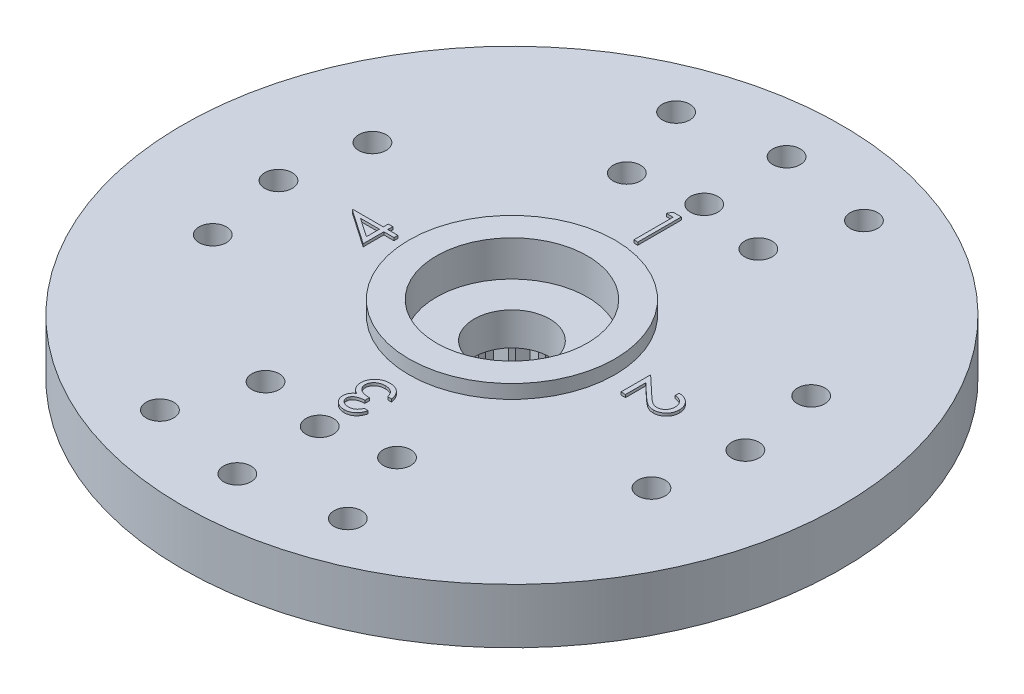
from build123d import *

# Parameters (mm, degrees)
SKETCH1_R           = 12
SKETCH1_R_2         = 1.375
SKETCH1_R_3         = 0.5
BOSS_EXTRUDE1_DEPTH = 2
SKETCH2_R           = 3.75
SKETCH2_R_2         = 2.75
BOSS_EXTRUDE2_DEPTH = 0.5
CUT_EXTRUDE1_START  = -0.8
SKETCH3_R           = 2.75
SKETCH3_R_2         = 1.375
CUT_EXTRUDE1_DEPTH  = 0.8
SKETCH4_R           = 4.5
SKETCH4_R_2         = 2.5
BOSS_EXTRUDE3_DEPTH = 2.5
CUT_EXTRUDE3_START  = -2.5
CUT_EXTRUDE3_DEPTH  = 2.5
BOSS_EXTRUDE4_DEPTH = 0.1


with BuildPart() as part:
    # Sketch1 → Boss-Extrude1 (new body)
    with BuildSketch(Plane(origin=(0, 0, 0), x_dir=(1, 0, 0), z_dir=(0, 1, 0))):
        with Locations(Location((0, 0, 0), (0, 0, 270))):
            Circle(SKETCH1_R)
        with Locations(Location((0, 0, 0), (0, 0, 270))):
            Circle(SKETCH1_R_2, mode=Mode.SUBTRACT)
        with Locations(Location((0, 10, 0), (0, 0, 270))):
            Circle(SKETCH1_R_3, mode=Mode.SUBTRACT)
        with Locations(Location((-3.420201433, 9.396926208, 0), (0, 0, 270))):
            Circle(SKETCH1_R_3, mode=Mode.SUBTRACT)
        with Locations(Location((3.420201433, 9.396926208, 0), (0, 0, 270))):
            Circle(SKETCH1_R_3, mode=Mode.SUBTRACT)
        with Locations(Location((0, 7, 0), (0, 0, 270))):
            Circle(SKETCH1_R_3, mode=Mode.SUBTRACT)
        with Locations(Location((-2.394141003, 6.577848346, 0), (0, 0, 270))):
            Circle(SKETCH1_R_3, mode=Mode.SUBTRACT)
        with Locations(Location((2.394141003, 6.577848346, 0), (0, 0, 270))):
            Circle(SKETCH1_R_3, mode=Mode.SUBTRACT)
        with Locations(Location((8.5, 0, 0), (0, 0, 270))):
            Circle(SKETCH1_R_3, mode=Mode.SUBTRACT)
        with Locations(Location((7.987387277, 2.907171218, 0), (0, 0, 270))):
            Circle(SKETCH1_R_3, mode=Mode.SUBTRACT)
        with Locations(Location((7.987387277, -2.907171218, 0), (0, 0, 270))):
            Circle(SKETCH1_R_3, mode=Mode.SUBTRACT)
        with Locations(Location((-2.394141003, -6.577848346, 0), (0, 0, 90))):
            Circle(SKETCH1_R_3, mode=Mode.SUBTRACT)
        with Locations(Location((0, -7, 0), (0, 0, 90))):
            Circle(SKETCH1_R_3, mode=Mode.SUBTRACT)
        with Locations(Location((2.394141003, -6.577848346, 0), (0, 0, 90))):
            Circle(SKETCH1_R_3, mode=Mode.SUBTRACT)
        with Locations(Location((3.420201433, -9.396926208, 0), (0, 0, 90))):
            Circle(SKETCH1_R_3, mode=Mode.SUBTRACT)
        with Locations(Location((0, -10, 0), (0, 0, 90))):
            Circle(SKETCH1_R_3, mode=Mode.SUBTRACT)
        with Locations(Location((-3.420201433, -9.396926208, 0), (0, 0, 90))):
            Circle(SKETCH1_R_3, mode=Mode.SUBTRACT)
        with Locations(Location((-7.987387277, -2.907171218, 0), (0, 0, 90))):
            Circle(SKETCH1_R_3, mode=Mode.SUBTRACT)
        with Locations(Location((-8.5, 0, 0), (0, 0, 90))):
            Circle(SKETCH1_R_3, mode=Mode.SUBTRACT)
        with Locations(Location((-7.987387277, 2.907171218, 0), (0, 0, 90))):
            Circle(SKETCH1_R_3, mode=Mode.SUBTRACT)
    extrude(amount=BOSS_EXTRUDE1_DEPTH)

    # Sketch2 → Boss-Extrude2 (add)
    with BuildSketch(Plane(origin=(0, 2, 0), x_dir=(1, 0, 0), z_dir=(0, 1, 0))):
        with Locations(Location((0, 0, 0), (0, 0, 270))):
            Circle(SKETCH2_R)
        with Locations(Location((0, 0, 0), (0, 0, 270))):
            Circle(SKETCH2_R_2, mode=Mode.SUBTRACT)
    extrude(amount=BOSS_EXTRUDE2_DEPTH)

    # Sketch3 → Cut-Extrude1 (cut)
    with BuildSketch(Plane(origin=(0, 2, 0), x_dir=(1, 0, 0), z_dir=(0, 1, 0)).offset(CUT_EXTRUDE1_START)):
        with Locations(Location((0, 0, 0), (0, 0, 270))):
            Circle(SKETCH3_R)
        with Locations(Location((0, 0, 0), (0, 0, 270))):
            Circle(SKETCH3_R_2, mode=Mode.SUBTRACT)
    extrude(amount=CUT_EXTRUDE1_DEPTH, mode=Mode.SUBTRACT)

    # Sketch4 → Boss-Extrude3 (add)
    with BuildSketch(Plane.XZ):
        with Locations(Location((0, 0, 0), (0, 0, 90))):
            Circle(SKETCH4_R)
        with Locations(Location((0, 0, 0), (0, 0, 270))):
            Circle(SKETCH4_R_2, mode=Mode.SUBTRACT)
    extrude(amount=BOSS_EXTRUDE3_DEPTH)

    # Sketch5 → Cut-Extrude3 (cut)
    with BuildSketch(Plane.XZ.offset(2.5).offset(CUT_EXTRUDE3_START)):
        with BuildLine():
            Line((0.299038106, 2.482050808), (0, 3))
            Line((0, 3), (-0.299038106, 2.482050808))
            ThreePointArc((-0.299038106, 2.482050808), (-0.391086163, 2.469220851), (-0.482593741, 2.452978451))
            Line((-0.482593741, 2.452978451), (-0.927050983, 2.853169549))
            Line((-0.927050983, 2.853169549), (-1.051398019, 2.268162738))
            ThreePointArc((-1.051398019, 2.268162738), (-1.134976249, 2.22751631), (-1.216985951, 2.183791473))
            Line((-1.216985951, 2.183791473), (-1.763355757, 2.427050983))
            Line((-1.763355757, 2.427050983), (-1.70083977, 1.832251096))
            ThreePointArc((-1.70083977, 1.832251096), (-1.767766953, 1.767766953), (-1.832251096, 1.70083977))
            Line((-1.832251096, 1.70083977), (-2.427050983, 1.763355757))
            Line((-2.427050983, 1.763355757), (-2.183791473, 1.216985951))
            ThreePointArc((-2.183791473, 1.216985951), (-2.22751631, 1.134976249), (-2.268162738, 1.051398019))
            Line((-2.268162738, 1.051398019), (-2.853169549, 0.927050983))
            Line((-2.853169549, 0.927050983), (-2.452978451, 0.482593741))
            ThreePointArc((-2.452978451, 0.482593741), (-2.469220851, 0.391086163), (-2.482050808, 0.299038106))
            Line((-2.482050808, 0.299038106), (-3, 0))
            Line((-3, 0), (-2.482050808, -0.299038106))
            ThreePointArc((-2.482050808, -0.299038106), (-2.469220851, -0.391086163), (-2.452978451, -0.482593741))
            Line((-2.452978451, -0.482593741), (-2.853169549, -0.927050983))
            Line((-2.853169549, -0.927050983), (-2.268162738, -1.051398019))
            ThreePointArc((-2.268162738, -1.051398019), (-2.22751631, -1.134976249), (-2.183791473, -1.216985951))
            Line((-2.183791473, -1.216985951), (-2.427050983, -1.763355757))
            Line((-2.427050983, -1.763355757), (-1.832251096, -1.70083977))
            ThreePointArc((-1.832251096, -1.70083977), (-1.767766953, -1.767766953), (-1.70083977, -1.832251096))
            Line((-1.70083977, -1.832251096), (-1.763355757, -2.427050983))
            Line((-1.763355757, -2.427050983), (-1.216985951, -2.183791473))
            ThreePointArc((-1.216985951, -2.183791473), (-1.134976249, -2.22751631), (-1.051398019, -2.268162738))
            Line((-1.051398019, -2.268162738), (-0.927050983, -2.853169549))
            Line((-0.927050983, -2.853169549), (-0.482593741, -2.452978451))
            ThreePointArc((-0.482593741, -2.452978451), (-0.391086163, -2.469220851), (-0.299038106, -2.482050808))
            Line((-0.299038106, -2.482050808), (0, -3))
            Line((0, -3), (0.299038106, -2.482050808))
            ThreePointArc((0.299038106, -2.482050808), (0.391086163, -2.469220851), (0.482593741, -2.452978451))
            Line((0.482593741, -2.452978451), (0.927050983, -2.853169549))
            Line((0.927050983, -2.853169549), (1.051398019, -2.268162738))
            ThreePointArc((1.051398019, -2.268162738), (1.134976249, -2.22751631), (1.216985951, -2.183791473))
            Line((1.216985951, -2.183791473), (1.763355757, -2.427050983))
            Line((1.763355757, -2.427050983), (1.70083977, -1.832251096))
            ThreePointArc((1.70083977, -1.832251096), (1.767766953, -1.767766953), (1.832251096, -1.70083977))
            Line((1.832251096, -1.70083977), (2.427050983, -1.763355757))
            Line((2.427050983, -1.763355757), (2.183791473, -1.216985951))
            ThreePointArc((2.183791473, -1.216985951), (2.22751631, -1.134976249), (2.268162738, -1.051398019))
            Line((2.268162738, -1.051398019), (2.853169549, -0.927050983))
            Line((2.853169549, -0.927050983), (2.452978451, -0.482593741))
            ThreePointArc((2.452978451, -0.482593741), (2.469220851, -0.391086163), (2.482050808, -0.299038106))
            Line((2.482050808, -0.299038106), (3, 0))
            Line((3, 0), (2.482050808, 0.299038106))
            ThreePointArc((2.482050808, 0.299038106), (2.469220851, 0.391086163), (2.452978451, 0.482593741))
            Line((2.452978451, 0.482593741), (2.853169549, 0.927050983))
            Line((2.853169549, 0.927050983), (2.268162738, 1.051398019))
            ThreePointArc((2.268162738, 1.051398019), (2.22751631, 1.134976249), (2.183791473, 1.216985951))
            Line((2.183791473, 1.216985951), (2.427050983, 1.763355757))
            Line((2.427050983, 1.763355757), (1.832251096, 1.70083977))
            ThreePointArc((1.832251096, 1.70083977), (1.767766953, 1.767766953), (1.70083977, 1.832251096))
            Line((1.70083977, 1.832251096), (1.763355757, 2.427050983))
            Line((1.763355757, 2.427050983), (1.216985951, 2.183791473))
            ThreePointArc((1.216985951, 2.183791473), (1.134976249, 2.22751631), (1.051398019, 2.268162738))
            Line((1.051398019, 2.268162738), (0.927050983, 2.853169549))
            Line((0.927050983, 2.853169549), (0.482593741, 2.452978451))
            ThreePointArc((0.482593741, 2.452978451), (0.391086163, 2.469220851), (0.299038106, 2.482050808))
        make_face()
    extrude(amount=CUT_EXTRUDE3_DEPTH, mode=Mode.SUBTRACT)

    # Sketch6 → Boss-Extrude4 (add)
    # profile 1 of 4: a face of its own
    with BuildSketch(Plane(origin=(0, 2, 0), x_dir=(1, 0, 0), z_dir=(0, 1, 0))):
        Polygon((-0.212111879, 6.0875), (0.081410256, 6.0875), (0.081410256, 4.5), (-0.061057692, 4.5), (-0.061057692, 5.924679487), (-0.305288462, 5.924679487), align=None)
    # profile 2 of 4: a face of its own
    with BuildSketch(Plane(origin=(0, 2, 0), x_dir=(1, 0, 0), z_dir=(0, 1, 0))):
        with BuildLine():
            Line((5.599038462, 0.34599359), (5.599038462, 0.488461538))
            add(Edge.make_bspline(
                [(5.599038462, 0.488461538), (5.617939279, 0.487533166), (5.655059981, 0.485709868), (5.709180577, 0.477167658), (5.760917347, 0.46495614), (5.809826741, 0.447649569), (5.856493025, 0.426277468), (5.900296523, 0.40011183), (5.941671981, 0.369710466), (5.979836023, 0.335129148), (6.014722729, 0.29760523), (6.045167992, 0.25736354), (6.070596953, 0.214817686), (6.091970581, 0.170336692), (6.107994605, 0.123406123), (6.119889389, 0.074474582), (6.127044708, 0.023320904), (6.12781392, -0.011531495), (6.128205128, -0.029256811)],
                knots=[0, 0, 0, 0, 1.100776268, 2.161895295, 3.184016182, 4.190939212, 5.176500551, 6.166955529, 7.155448256, 8.160289653, 9.16017456, 10.133824356, 11.091467644, 12.04088621, 13.000931625, 13.972173743, 14.968683325, 16, 16, 16, 16], degree=3))
            add(Edge.make_bspline(
                [(6.128205128, -0.029256811), (6.127797614, -0.046664009), (6.126996863, -0.080868531), (6.120120254, -0.130789516), (6.109349932, -0.178313503), (6.094239011, -0.223347597), (6.073926074, -0.265532491), (6.049525047, -0.305185086), (6.02130391, -0.342777454), (5.988078073, -0.376616959), (5.952607706, -0.407690267), (5.914739978, -0.434497361), (5.875628838, -0.457454046), (5.834976046, -0.476589172), (5.79239883, -0.490675349), (5.748517063, -0.501369751), (5.702876523, -0.507414685), (5.671985336, -0.50834243), (5.656280048, -0.508814103)],
                knots=[0, 0, 0, 0, 1.111607364, 2.184268762, 3.212621178, 4.221274766, 5.211760367, 6.196651075, 7.1921475, 8.207485113, 9.220403448, 10.201281604, 11.166441695, 12.114753415, 13.065576456, 14.026450734, 14.996634279, 16, 16, 16, 16], degree=3))
            add(Edge.make_bspline(
                [(5.656280048, -0.508814103), (5.634169423, -0.508046087), (5.590336183, -0.506523533), (5.525922299, -0.493499512), (5.463513856, -0.473158416), (5.413286579, -0.448666758), (5.372812816, -0.423959614), (5.339489511, -0.401694923), (5.30360953, -0.375630526), (5.265293024, -0.345387065), (5.224239863, -0.311590155), (5.180474849, -0.273933674), (5.134450153, -0.232149094), (5.103015113, -0.202821846), (5.086726262, -0.1876252)],
                knots=[0, 0, 0, 0, 1.184426356, 2.348067706, 3.509069118, 4.696110526, 5.333549288, 6.050745305, 6.844228056, 7.710549037, 8.667450064, 9.695053472, 10.805634456, 12, 12, 12, 12], degree=3))
            Line((5.086726262, -0.1876252), (4.662820513, 0.209567808))
            Line((4.662820513, 0.209567808), (4.662820513, -0.529166667))
            Line((4.662820513, -0.529166667), (4.5, -0.529166667))
            Line((4.5, -0.529166667), (4.5, 0.549519231))
            Line((4.5, 0.549519231), (5.15700621, -0.066145833))
            add(Edge.make_bspline(
                [(5.15700621, -0.066145833), (5.172652803, -0.081136472), (5.202706705, -0.10993042), (5.246597776, -0.15063927), (5.287268318, -0.187261175), (5.324898551, -0.219820431), (5.359275147, -0.248343825), (5.390667508, -0.272740096), (5.418806234, -0.293117072), (5.451862432, -0.31471242), (5.492269991, -0.335305017), (5.541401752, -0.353403803), (5.592090897, -0.364360562), (5.626334746, -0.36568164), (5.643559696, -0.366346154)],
                knots=[0, 0, 0, 0, 1.329530082, 2.553755191, 3.672934919, 4.687409497, 5.60679272, 6.413407421, 7.126401618, 7.737995624, 8.834647426, 9.90044882, 10.943907757, 12, 12, 12, 12], degree=3))
            add(Edge.make_bspline(
                [(5.643559696, -0.366346154), (5.654392812, -0.366060761), (5.675742806, -0.365498307), (5.707024672, -0.360440353), (5.737316681, -0.353009214), (5.766244292, -0.341555532), (5.794376458, -0.327794356), (5.820857871, -0.310213439), (5.846591221, -0.290123068), (5.87069413, -0.266819222), (5.892776139, -0.241235929), (5.912335573, -0.214204803), (5.928681993, -0.185607306), (5.94208205, -0.155562618), (5.952593749, -0.124154868), (5.959877459, -0.091323211), (5.964450586, -0.057158391), (5.965069336, -0.033829626), (5.965384615, -0.021942608)],
                knots=[0, 0, 0, 0, 0.991504627, 1.954065223, 2.895985987, 3.842598665, 4.797835564, 5.759220273, 6.74786863, 7.784730864, 8.824135544, 9.839918996, 10.835834653, 11.835434876, 12.84861661, 13.863796685, 14.911511676, 16, 16, 16, 16], degree=3))
            add(Edge.make_bspline(
                [(5.965384615, -0.021942608), (5.965060395, -0.009527925), (5.964423681, 0.014852462), (5.959967009, 0.050647099), (5.952285925, 0.084797422), (5.941755322, 0.117372561), (5.928497209, 0.148403903), (5.911665037, 0.177610862), (5.891915995, 0.205260088), (5.869403165, 0.231300798), (5.844219896, 0.255228126), (5.816492727, 0.276692883), (5.786041295, 0.295000051), (5.753553406, 0.311228532), (5.718165248, 0.323645722), (5.680734357, 0.334259816), (5.64072893, 0.341970171), (5.613166096, 0.344630175), (5.599038462, 0.34599359)],
                knots=[0, 0, 0, 0, 1.031212865, 2.025131798, 2.990757446, 3.934781266, 4.865570067, 5.788494791, 6.729227313, 7.684356718, 8.643577152, 9.610526866, 10.590658432, 11.59095419, 12.621640561, 13.700587263, 14.82141059, 16, 16, 16, 16], degree=3))
        make_face()
    # profile 3 of 4: a face of its own
    with BuildSketch(Plane(origin=(0, 2, 0), x_dir=(1, 0, 0), z_dir=(0, 1, 0))):
        with BuildLine():
            Line((0.34599359, -5.721153846), (0.488461538, -5.721153846))
            add(Edge.make_bspline(
                [(0.488461538, -5.721153846), (0.484601849, -5.737134294), (0.477056473, -5.768374763), (0.461318645, -5.813009485), (0.444173983, -5.855247654), (0.423586782, -5.894298373), (0.401131025, -5.930946447), (0.37540322, -5.964360657), (0.347590345, -5.995390823), (0.316826886, -6.022928613), (0.284564958, -6.04786494), (0.250349969, -6.069126127), (0.2148703, -6.08741601), (0.177880129, -6.102483759), (0.139269329, -6.113834621), (0.099386965, -6.122070029), (0.05812852, -6.127418142), (0.030121577, -6.127940095), (0.015900441, -6.128205128)],
                knots=[0, 0, 0, 0, 1.162005537, 2.271625781, 3.343758855, 4.383309926, 5.390229558, 6.379919256, 7.361854164, 8.333198761, 9.295911338, 10.242430842, 11.177959212, 12.116337295, 13.062827104, 14.020064771, 14.994644689, 16, 16, 16, 16], degree=3))
            add(Edge.make_bspline(
                [(0.015900441, -6.128205128), (-0.004819946, -6.127579549), (-0.045808747, -6.126342036), (-0.106026272, -6.115041559), (-0.164095579, -6.097159445), (-0.21938106, -6.072451719), (-0.270733706, -6.041977474), (-0.316424762, -6.005707754), (-0.355834908, -5.964342356), (-0.388897715, -5.918652943), (-0.414785304, -5.86982348), (-0.43387448, -5.819567694), (-0.445495743, -5.7680048), (-0.447001853, -5.733189891), (-0.44775641, -5.715747696)],
                knots=[0, 0, 0, 0, 1.083050992, 2.142477498, 3.193116406, 4.255571735, 5.30263384, 6.308962982, 7.297363603, 8.282367274, 9.249857812, 10.179914175, 11.08814088, 12, 12, 12, 12], degree=3))
            add(Edge.make_bspline(
                [(-0.44775641, -5.715747696), (-0.447228639, -5.698962472), (-0.446195871, -5.666116392), (-0.437426655, -5.618164141), (-0.422669136, -5.572969558), (-0.402226779, -5.530342388), (-0.375764719, -5.490552907), (-0.343709603, -5.453511592), (-0.305835181, -5.419054153), (-0.277133663, -5.399314963), (-0.262357272, -5.389152644)],
                knots=[0, 0, 0, 0, 1.024540389, 2.004866551, 2.965041327, 3.920577974, 4.882998113, 5.874504559, 6.905732034, 8, 8, 8, 8], degree=3))
            add(Edge.make_bspline(
                [(-0.262357272, -5.389152644), (-0.279266057, -5.38102782), (-0.312821544, -5.364904106), (-0.358097689, -5.332780608), (-0.399825574, -5.296601576), (-0.422822908, -5.268052723), (-0.43440004, -5.253680889)],
                knots=[0, 0, 0, 0, 1.015663554, 2.015584519, 3.001021554, 4, 4, 4, 4], degree=3))
            add(Edge.make_bspline(
                [(-0.43440004, -5.253680889), (-0.442041901, -5.243223667), (-0.457200483, -5.222480465), (-0.475858316, -5.189110161), (-0.492978135, -5.155480456), (-0.505577827, -5.120269074), (-0.516450862, -5.084607067), (-0.523604956, -5.047730768), (-0.528197599, -5.009990535), (-0.5288425, -4.984446887), (-0.529166667, -4.971607071)],
                knots=[0, 0, 0, 0, 1.02516404, 2.033540309, 3.025129118, 4.011046665, 4.991655828, 5.976607087, 6.982917762, 8, 8, 8, 8], degree=3))
            add(Edge.make_bspline(
                [(-0.529166667, -4.971607071), (-0.528350817, -4.94937866), (-0.526722958, -4.905026444), (-0.512235463, -4.839481871), (-0.489636803, -4.775530087), (-0.458141824, -4.71407805), (-0.418998333, -4.656756936), (-0.372686258, -4.605322495), (-0.319156288, -4.561514187), (-0.259966982, -4.524586511), (-0.195593193, -4.495321744), (-0.127013944, -4.474234108), (-0.05463527, -4.461584484), (-0.005138768, -4.460066765), (0.020034555, -4.459294872)],
                knots=[0, 0, 0, 0, 0.955619592, 1.906742024, 2.874954321, 3.868585453, 4.869520953, 5.854611167, 6.836527075, 7.836578462, 8.849204403, 9.870874567, 10.917152508, 12, 12, 12, 12], degree=3))
            add(Edge.make_bspline(
                [(0.020034555, -4.459294872), (0.037005812, -4.459692103), (0.070399587, -4.460473722), (0.11951096, -4.465721886), (0.166290723, -4.475567824), (0.211193125, -4.487950453), (0.253540479, -4.505070826), (0.293941914, -4.525481482), (0.332220335, -4.549705826), (0.36814842, -4.577784596), (0.401687783, -4.60921458), (0.431983954, -4.644517919), (0.459372127, -4.683035728), (0.48367828, -4.725114484), (0.50500471, -4.770636328), (0.52289247, -4.819783675), (0.538510693, -4.872175513), (0.545786309, -4.908676289), (0.549519231, -4.927403846)],
                knots=[0, 0, 0, 0, 1.048603596, 2.063302207, 3.045874044, 3.999447474, 4.937100059, 5.862643889, 6.7929026, 7.7308982, 8.676022965, 9.627908155, 10.600123445, 11.591992905, 12.626222643, 13.701663232, 14.820785756, 16, 16, 16, 16], degree=3))
            Line((0.549519231, -4.927403846), (0.407051282, -4.927403846))
            add(Edge.make_bspline(
                [(0.407051282, -4.927403846), (0.403339575, -4.915180544), (0.396119982, -4.891405159), (0.383830783, -4.857187592), (0.369829816, -4.825819475), (0.354809999, -4.797070701), (0.339035489, -4.770658147), (0.321384791, -4.747280228), (0.303165214, -4.725910119), (0.289431365, -4.713870241), (0.282709836, -4.707977764)],
                knots=[0, 0, 0, 0, 1.198163088, 2.33053128, 3.407730985, 4.417276592, 5.372219308, 6.28897303, 7.162600585, 8, 8, 8, 8], degree=3))
            add(Edge.make_bspline(
                [(0.282709836, -4.707977764), (0.273820396, -4.701127882), (0.256068955, -4.68744926), (0.227160407, -4.669943613), (0.196651098, -4.654959198), (0.164286602, -4.642779237), (0.130062577, -4.63363652), (0.094117851, -4.627056022), (0.056393446, -4.622711871), (0.030647277, -4.622317113), (0.017490485, -4.622115385)],
                knots=[0, 0, 0, 0, 0.946083416, 1.889246487, 2.84504177, 3.809995578, 4.801312957, 5.829064617, 6.89060985, 8, 8, 8, 8], degree=3))
            add(Edge.make_bspline(
                [(0.017490485, -4.622115385), (0.002634231, -4.622394287), (-0.026415892, -4.622939657), (-0.068801536, -4.627969629), (-0.109137453, -4.635263244), (-0.147012014, -4.646671877), (-0.182940598, -4.660358417), (-0.216121178, -4.678276609), (-0.247529219, -4.69851231), (-0.276244612, -4.722050322), (-0.302132943, -4.747492366), (-0.324503322, -4.774484107), (-0.343878628, -4.802188626), (-0.35945314, -4.831252213), (-0.371773311, -4.861389777), (-0.380155306, -4.892714125), (-0.385984774, -4.924961484), (-0.386459435, -4.946882168), (-0.386698718, -4.957932692)],
                knots=[0, 0, 0, 0, 1.216990249, 2.379719373, 3.493992396, 4.571561497, 5.616923107, 6.638958652, 7.655775068, 8.674704564, 9.676001865, 10.625896028, 11.54399481, 12.441854662, 13.322657739, 14.20572845, 15.095482574, 16, 16, 16, 16], degree=3))
            add(Edge.make_bspline(
                [(-0.386698718, -4.957932692), (-0.386003169, -4.972723335), (-0.384615531, -5.002231023), (-0.374065118, -5.0456597), (-0.356555994, -5.087519235), (-0.332520572, -5.127261442), (-0.302560837, -5.163663871), (-0.268092983, -5.196247969), (-0.228381575, -5.223379244), (-0.191624295, -5.242072337), (-0.158981256, -5.254526807), (-0.131102444, -5.263260269), (-0.099863368, -5.270241472), (-0.06563939, -5.276994458), (-0.028286064, -5.282655717), (0.012230232, -5.287397248), (0.055925805, -5.291185256), (0.086174952, -5.292877803), (0.101762821, -5.29375)],
                knots=[0, 0, 0, 0, 1.070440979, 2.135555593, 3.216243406, 4.345886539, 5.486149072, 6.621334998, 7.769144672, 8.957074012, 9.598644492, 10.297969361, 11.070758978, 11.915404831, 12.824182859, 13.805940418, 14.869366021, 16, 16, 16, 16], degree=3))
            Line((0.101762821, -5.29375), (0.101762821, -5.456570513))
            add(Edge.make_bspline(
                [(0.101762821, -5.456570513), (0.082130288, -5.456953283), (0.043688426, -5.457702772), (-0.012623157, -5.464900992), (-0.066305692, -5.47658472), (-0.116551716, -5.492896722), (-0.162112282, -5.512755295), (-0.202016873, -5.53498931), (-0.234829912, -5.560639777), (-0.261139083, -5.588494162), (-0.280652882, -5.618558339), (-0.295056815, -5.64975068), (-0.303576438, -5.682651469), (-0.304715777, -5.70510004), (-0.305288462, -5.716383714)],
                knots=[0, 0, 0, 0, 1.321816535, 2.58820849, 3.816448615, 5.017641336, 6.139869627, 7.160068286, 8.085608132, 8.934319198, 9.728416342, 10.48890201, 11.240453369, 12, 12, 12, 12], degree=3))
            add(Edge.make_bspline(
                [(-0.305288462, -5.716383714), (-0.305104632, -5.724675376), (-0.304738912, -5.741171245), (-0.299942506, -5.765346601), (-0.293068021, -5.788783239), (-0.283080788, -5.811207319), (-0.270164259, -5.832690124), (-0.254537181, -5.853310117), (-0.236159971, -5.8732642), (-0.215151965, -5.892112288), (-0.191706493, -5.9090759), (-0.166764563, -5.924198724), (-0.140228938, -5.936914866), (-0.112272542, -5.947455684), (-0.082744259, -5.95537096), (-0.051799429, -5.961057912), (-0.019374439, -5.964612556), (0.002746995, -5.965124413), (0.013992388, -5.965384615)],
                knots=[0, 0, 0, 0, 0.884246871, 1.759167212, 2.622361933, 3.489113179, 4.372562419, 5.294145153, 6.247651513, 7.265905295, 8.30305477, 9.334068495, 10.37719476, 11.441246459, 12.52060732, 13.637552802, 14.799054011, 16, 16, 16, 16], degree=3))
            add(Edge.make_bspline(
                [(0.013992388, -5.965384615), (0.032068563, -5.964754757), (0.067375538, -5.963524498), (0.118264696, -5.952711076), (0.16552422, -5.935578323), (0.201526445, -5.914890575), (0.228156868, -5.894539373), (0.24755157, -5.877031234), (0.266250048, -5.85718059), (0.283518559, -5.83444296), (0.300391868, -5.809600201), (0.31670886, -5.782515486), (0.331945433, -5.752802669), (0.341220184, -5.73190776), (0.34599359, -5.721153846)],
                knots=[0, 0, 0, 0, 1.4727372, 2.876598283, 4.222346151, 5.558423782, 6.24313385, 6.953189256, 7.68715613, 8.463578749, 9.278833271, 10.135787152, 11.040551781, 12, 12, 12, 12], degree=3))
        make_face()
    # profile 4 of 4: a face of its own
    with BuildSketch(Plane(origin=(0, 2, 0), x_dir=(1, 0, 0), z_dir=(0, 1, 0))):
        Polygon((-6.128205128, 0.317054788), (-6.128205128, 0.34599359), (-5.029166667, 0.34599359), (-5.029166667, 0.529166667), (-4.866346154, 0.529166667), (-4.866346154, 0.34599359), (-4.5, 0.34599359), (-4.5, 0.203525641), (-4.866346154, 0.203525641), (-4.866346154, -0.549519231), align=None)
        Polygon((-5.029166667, 0.203525641), (-5.718609776, 0.203525641), (-5.029166667, -0.269671474), align=None, mode=Mode.SUBTRACT)
    extrude(amount=BOSS_EXTRUDE4_DEPTH)


solid = part.part
